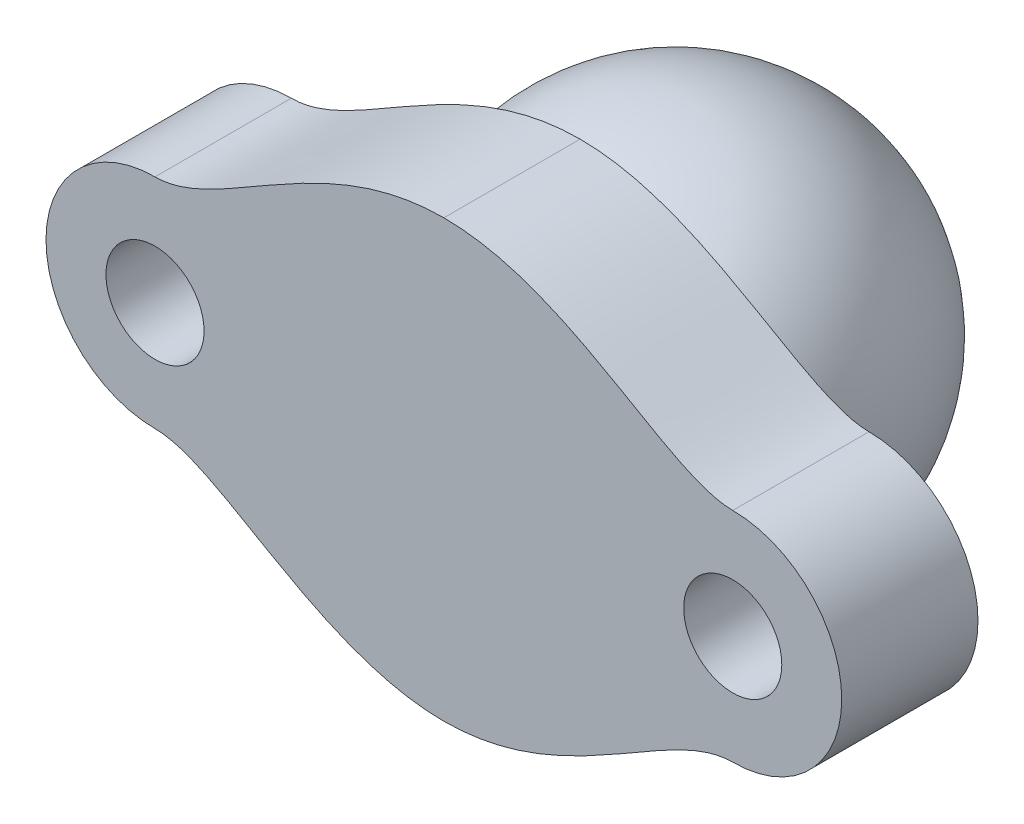
from build123d import *

# Parameters (mm, degrees)
SKETCH1_R           = 1.143
BOSS_EXTRUDE1_DEPTH = 3.175


with BuildPart() as part:
    # Sketch1 → Boss-Extrude1 (new body)
    with BuildSketch(Plane.XY):
        with BuildLine():
            ThreePointArc((-6.731, -2.54), (-9.271, 0), (-6.731, 2.54))
            add(Edge.make_bspline(
                [(-6.731, 2.54), (-5.187542856, 2.54), (-2.92113625, 5.080180466), (0, 5.08)],
                knots=[0, 0, 0, 0, 1, 1, 1, 1], degree=3))
            add(Edge.make_bspline(
                [(6.731, 2.54), (5.187542856, 2.54), (2.92113625, 5.080180466), (0, 5.08)],
                knots=[0, 0, 0, 0, 1, 1, 1, 1], degree=3))
            ThreePointArc((6.731, 2.54), (9.271, 0), (6.731, -2.54))
            add(Edge.make_bspline(
                [(6.731, -2.54), (5.187542856, -2.54), (2.92113625, -5.080180466), (0, -5.08)],
                knots=[0, 0, 0, 0, 1, 1, 1, 1], degree=3))
            add(Edge.make_bspline(
                [(-6.731, -2.54), (-5.187542856, -2.54), (-2.92113625, -5.080180466), (0, -5.08)],
                knots=[0, 0, 0, 0, 1, 1, 1, 1], degree=3))
        make_face()
        with Locations((6.731, 0)):
            Circle(SKETCH1_R, mode=Mode.SUBTRACT)
        with Locations((-6.731, 0)):
            Circle(SKETCH1_R, mode=Mode.SUBTRACT)
    extrude(amount=BOSS_EXTRUDE1_DEPTH)

    # Sketch4 → Revolve1 (revolve)
    with BuildSketch(Plane(origin=(0, 0, 0), x_dir=(1, 0, 0), z_dir=(0, 1, 0))):
        with BuildLine():
            Line((0, 0), (4.212113484, 0))
            ThreePointArc((4.212113484, 0), (4.078361344, 4.681844425), (0, 6.985))
            Line((0, 6.985), (0, 0))
        make_face()
    revolve(axis=Axis((0, 0, 0), (0, 0, -1)))


solid = part.part
